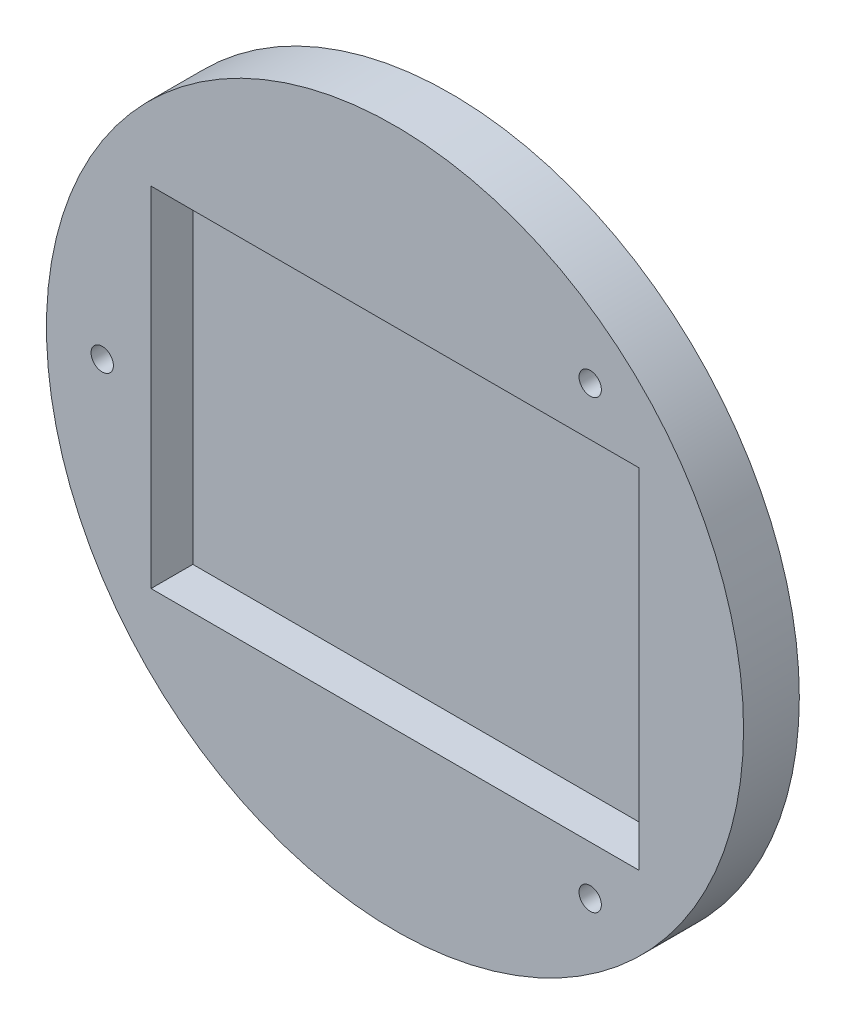
from build123d import *

# Parameters (mm, degrees)
SKETCH1_R             = 25
SKETCH1_W             = 35
SKETCH1_H             = 25
BOSS_EXTRUDE1_DEPTH   = 4
SKETCH1_3_W           = 35
SKETCH1_3_H           = 25
BOSS_EXTRUDE2_DEPTH   = 1
M2X0_4_TAPPED_HOLE1_D = 1.6


with BuildPart() as part:
    # Sketch1 → Boss-Extrude1 (new body)
    with BuildSketch(Plane.XY):
        Circle(SKETCH1_R)
        Rectangle(SKETCH1_W, SKETCH1_H, mode=Mode.SUBTRACT)
    extrude(amount=BOSS_EXTRUDE1_DEPTH)

    # Sketch1<3> → Boss-Extrude2 (add)
    with BuildSketch(Plane.XY):
        Rectangle(SKETCH1_3_W, SKETCH1_3_H)
    extrude(amount=BOSS_EXTRUDE2_DEPTH)

    # Sketch2 → Revolve1 (revolve)
    with BuildSketch(Plane(origin=(0, 0, 0), x_dir=(1, 0, 0), z_dir=(0, 1, 0))):
        with BuildLine():
            Line((0, 6.5), (0, 0))
            Line((0, 0), (-6.5, 0))
            ThreePointArc((-6.5, 0), (-4.596194078, 4.596194078), (0, 6.5))
        make_face()
    revolve(axis=Axis((0, 0, -15), (0, 0, 1)))

    # M2x0.4 Tapped Hole1 (through all)
    with Locations(Plane.XY.offset(4)):
        with Locations((-21, 0), (14, -16), (14, 16)):
            Hole(M2X0_4_TAPPED_HOLE1_D / 2)


solid = part.part
